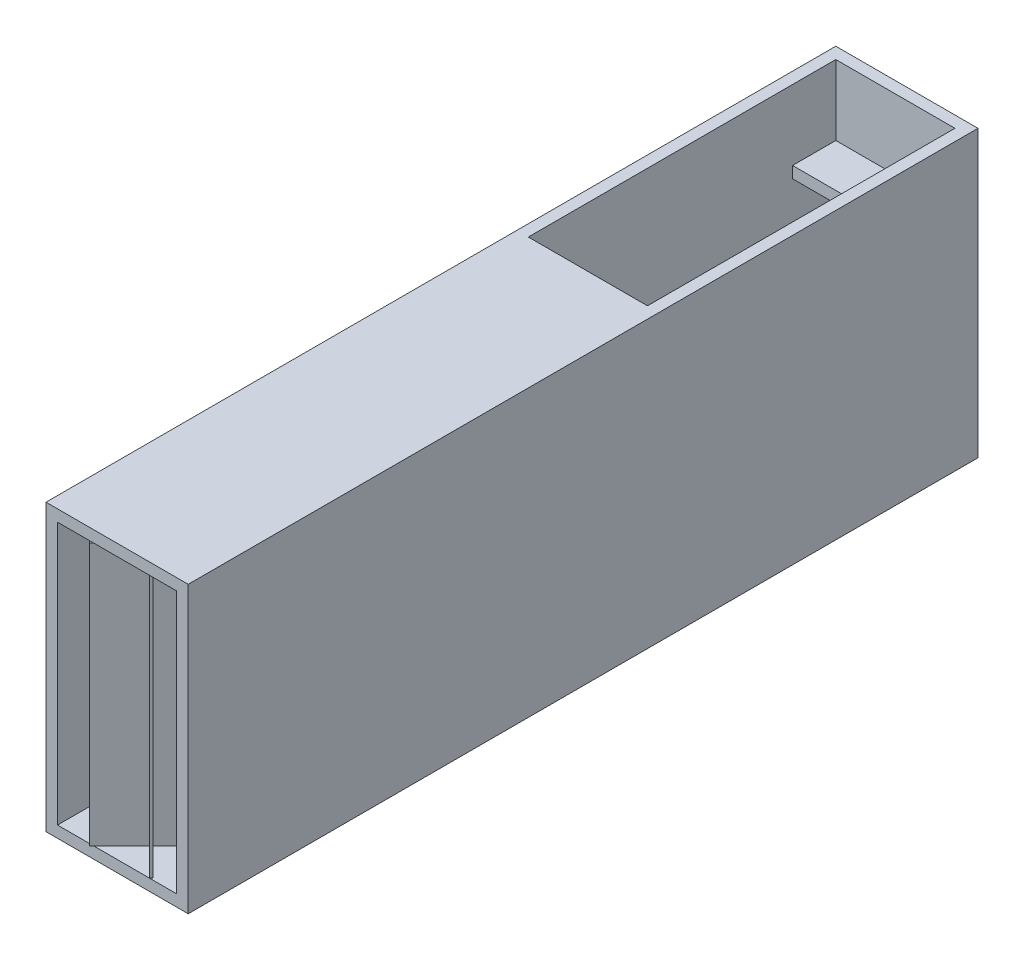
from build123d import *

# Parameters (mm, degrees)
SKETCH2_W           = 12.4
SKETCH2_H           = 27.3
BOSS_EXTRUDE1_DEPTH = 81
SKETCH3_W           = 12.4
SKETCH3_H           = 1.2
BOSS_EXTRUDE2_DEPTH = 4.5
SKETCH6_W           = 12.4
SKETCH6_H           = 1.2
BOSS_EXTRUDE3_DEPTH = 4.5
SKETCH7_R           = 1
CUT_EXTRUDE2_DEPTH  = 4.5
SKETCH9_R           = 1
CUT_EXTRUDE3_DEPTH  = 1.2
SKETCH11_W          = 12.4
SKETCH11_H          = 32
CUT_EXTRUDE4_DEPTH  = 2
SKETCH12_R          = 1.5
CUT_EXTRUDE5_DEPTH  = 3
SKETCH13_W          = 14.8
SKETCH13_H          = 29.7
BOSS_EXTRUDE4_DEPTH = 1.2
EXTRUDE_THIN4_DEPTH = 27.3


with BuildPart() as part:
    # Sketch2 → Boss-Extrude1 (new body)
    with BuildSketch(Plane(origin=(0, 0, 16), x_dir=(-1, 0, 0), z_dir=(0, 0, -1))):
        Polygon((-1.710644683, 9.412349839), (10.689355317, 9.412349839), (11.889355317, 9.412349839), (11.889355317, -20.287650161), (-2.910644683, -20.287650161), (-2.910644683, 9.412349839), align=None)
        with Locations((4.489355317, -5.437650161)):
            Rectangle(SKETCH2_W, SKETCH2_H, mode=Mode.SUBTRACT)
    extrude(amount=-BOSS_EXTRUDE1_DEPTH)

    # Sketch3 → Boss-Extrude2 (add)
    with BuildSketch(Plane(origin=(0, 0, 20.5), x_dir=(-1, 0, 0), z_dir=(0, 0, -1))):
        with Locations((4.489355317, 1.512349839)):
            Rectangle(SKETCH3_W, SKETCH3_H)
    extrude(amount=BOSS_EXTRUDE2_DEPTH)

    # Sketch6 → Boss-Extrude3 (add)
    with BuildSketch(Plane.XY.offset(43.5)):
        with Locations((-4.489355317, 1.512349839)):
            Rectangle(SKETCH6_W, SKETCH6_H)
    extrude(amount=BOSS_EXTRUDE3_DEPTH)

    # Sketch7 → Cut-Extrude2 (cut)
    with BuildSketch(Plane(origin=(0, 2.112349839, 0), x_dir=(1, 0, 0), z_dir=(0, 1, 0))):
        with Locations(Location((-4.489355317, -46.25, 0), (0, 0, 270))):
            Circle(SKETCH7_R)
    extrude(amount=-CUT_EXTRUDE2_DEPTH, mode=Mode.SUBTRACT)

    # Sketch9 → Cut-Extrude3 (cut)
    with BuildSketch(Plane(origin=(0, 2.112349839, 0), x_dir=(1, 0, 0), z_dir=(0, 1, 0))):
        with Locations(Location((-4.489355317, -17.75, 0), (0, 0, 270))):
            Circle(SKETCH9_R)
    extrude(amount=-CUT_EXTRUDE3_DEPTH, mode=Mode.SUBTRACT)

    # Sketch11 → Cut-Extrude4 (cut)
    with BuildSketch(Plane(origin=(0, 9.412349839, 0), x_dir=(1, 0, 0), z_dir=(0, 1, 0))):
        with Locations((-4.489355317, -32)):
            Rectangle(SKETCH11_W, SKETCH11_H)
    extrude(amount=-CUT_EXTRUDE4_DEPTH, mode=Mode.SUBTRACT)

    # Sketch12 → Cut-Extrude5 (cut)
    with BuildSketch(Plane.XZ.offset(20.287650161)):
        with Locations((-4.489355317, 27)):
            Circle(SKETCH12_R)
    extrude(amount=-CUT_EXTRUDE5_DEPTH, mode=Mode.SUBTRACT)

    # Sketch13 → Boss-Extrude4 (add)
    with BuildSketch(Plane(origin=(0, 0, 16), x_dir=(-1, 0, 0), z_dir=(0, 0, -1))):
        with Locations((4.489355317, -5.437650161)):
            Rectangle(SKETCH13_W, SKETCH13_H)
    extrude(amount=BOSS_EXTRUDE4_DEPTH)

    # Sketch14 → Extrude-Thin4 (add)
    with BuildSketch(Plane.XZ.offset(-8.212349839)):
        Polygon((-11.186012312, 48.649869812), (2.450882677, 62.2867648), (2.648872575, 62.088774902), (-10.988022413, 48.451879913), align=None)
        Polygon((2.450882677, 48.896001763), (-11.245895089, 62.592779529), (-11.04790519, 62.790769427), (2.648872575, 49.093991662), align=None)
        Polygon((-11.186012312, 58.226694419), (2.450882677, 71.863589408), (2.648872575, 71.665599509), (-10.988022413, 58.02870452), align=None)
        Polygon((2.450882677, 58.47282637), (-11.245895089, 72.169604136), (-11.04790519, 72.367594035), (2.648872575, 58.670816269), align=None)
        Polygon((-11.186012312, 67.803519026), (2.450882677, 81.440414015), (2.648872575, 81.242424116), (-10.988022413, 67.605529127), align=None)
        Polygon((2.450882677, 68.049650977), (-11.245895089, 81.746428743), (-11.04790519, 81.944418642), (2.648872575, 68.247640876), align=None)
        Polygon((-11.186012312, 77.380343633), (2.450882677, 91.017238622), (2.648872575, 90.819248723), (-10.988022413, 77.182353735), align=None)
        Polygon((2.450882677, 77.626475585), (-11.245895089, 91.32325335), (-11.04790519, 91.521243249), (2.648872575, 77.824465483), align=None)
        Polygon((-10.82008194, 87.323098613), (-1.143180553, 97), (-0.945190654, 96.802010101), (-10.622092041, 87.125108714), align=None)
        Polygon((1.710644683, 87.943538186), (-7.345817131, 97), (-7.147827233, 97.197989899), (1.908634582, 88.141528084), align=None)
    extrude(amount=EXTRUDE_THIN4_DEPTH)


solid = part.part
